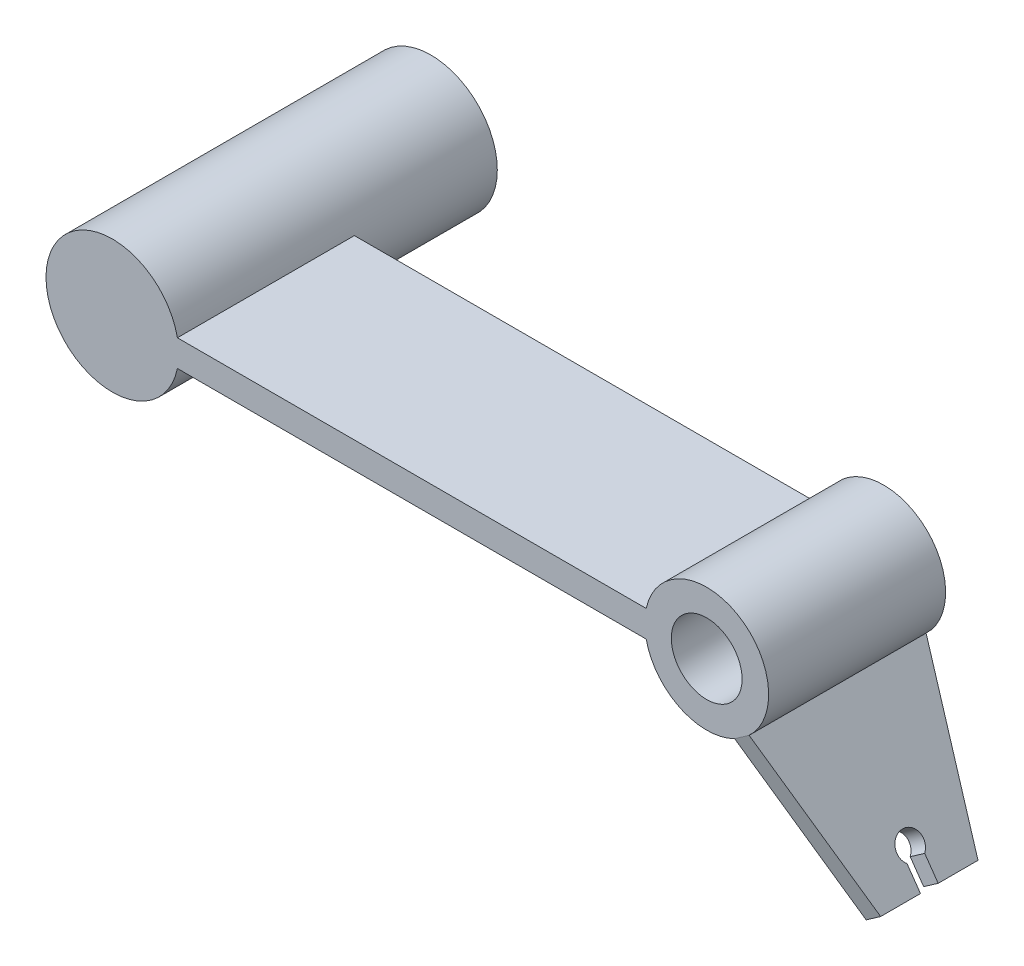
from build123d import *

# Parameters (mm, degrees)
SKETCH2_R           = 4
BOSS_EXTRUDE1_DEPTH = 20
SKETCH3_R           = 7.5
BOSS_EXTRUDE2_DEPTH = 36
BOSS_EXTRUDE3_START = -20
BOSS_EXTRUDE3_DEPTH = 20
CUT_EXTRUDE1_DEPTH  = 2
CUT_EXTRUDE2_REACH  = 83.026
BOSS_EXTRUDE4_DEPTH = 2


with BuildPart() as part:
    # Sketch2 → Boss-Extrude1 (new body)
    with BuildSketch(Plane.XY):
        with BuildLine():
            Line((-67.162602834, 1.5), (-6.837397166, 1.5))
            ThreePointArc((-6.837397166, 1.5), (7, 0), (-6.837397166, -1.5))
            Line((-6.837397166, -1.5), (-67.162602834, -1.5))
            Line((-67.162602834, -1.5), (-67.162602834, 1.5))
        make_face()
        Circle(SKETCH2_R, mode=Mode.SUBTRACT)
    extrude(amount=BOSS_EXTRUDE1_DEPTH)

    # Sketch3 → Boss-Extrude2 (add)
    with BuildSketch(Plane.XY.offset(20)):
        with Locations((-67.162602834, 0)):
            Circle(SKETCH3_R)
    extrude(amount=-BOSS_EXTRUDE2_DEPTH)

    # Sketch4 → Boss-Extrude3 (add)
    with BuildSketch(Plane.XY.offset(20).offset(BOSS_EXTRUDE3_START)):
        with BuildLine():
            Line((15.158562953, -19.905224671), (13.520258864, -21.052377544))
            Line((13.520258864, -21.052377544), (3.154702075, -6.248828276))
            ThreePointArc((3.154702075, -6.248828276), (4.015035054, -5.73406431), (4.793006163, -5.101675403))
            Line((4.793006163, -5.101675403), (15.158562953, -19.905224671))
        make_face()
    extrude(amount=BOSS_EXTRUDE3_DEPTH)

    # Sketch5 → Cut-Extrude1 (cut)
    with BuildSketch(Plane(origin=(0.8191520442889967, 0.5735764363510467, 0), x_dir=(0, 0, -1), z_dir=(0.8191520442889931, 0.5735764363510442, 0))):
        with BuildLine():
            Line((-11, -22.346237219), (-11, -25))
            Line((-11, -25), (-9, -25))
            Line((-9, -25), (-9, -22.346237219))
            ThreePointArc((-9, -22.346237219), (-10, -19.72820323), (-11, -22.346237219))
        make_face()
    extrude(amount=-CUT_EXTRUDE1_DEPTH, mode=Mode.SUBTRACT)

    # Sketch6 → Cut-Extrude2 (cut, up to next)
    with BuildSketch(Plane(origin=(0.8191520442889967, 0.5735764363510467, 0), x_dir=(0, 0, -1), z_dir=(0.8191520442889931, 0.5735764363510442, 0)), mode=Mode.PRIVATE) as cut_extrude2_sk1:
        Polygon((-20, -6.92820323), (-15.5, -25), (-21.37977423, -25), (-21.37977423, -6.621098629), align=None)
    cut_extrude2_tool1 = extrude(cut_extrude2_sk1.sketch, amount=-CUT_EXTRUDE2_REACH, mode=Mode.PRIVATE) & part.part
    # Sketch6 → Cut-Extrude2 (cut, up to next)
    with BuildSketch(Plane(origin=(0.8191520442889967, 0.5735764363510467, 0), x_dir=(0, 0, -1), z_dir=(0.8191520442889931, 0.5735764363510442, 0)), mode=Mode.PRIVATE) as cut_extrude2_sk2:
        Polygon((0, -6.92820323), (1.41409792, -6.92820323), (1.41409792, -25), (-4.5, -25), align=None)
    cut_extrude2_tool2 = extrude(cut_extrude2_sk2.sketch, amount=-CUT_EXTRUDE2_REACH, mode=Mode.PRIVATE) & part.part
    add(cut_extrude2_tool1.solids().sort_by_distance((11.026351, -14.003814, 19.337545))[0], mode=Mode.SUBTRACT)
    add(cut_extrude2_tool2.solids().sort_by_distance((11.036642, -14.018511, 0.648226))[0], mode=Mode.SUBTRACT)

    # Sketch7 → Boss-Extrude4 (add)
    with BuildSketch(Plane.XY.offset(9)):
        Polygon((-25.248427633, -1.5), (8.33748047, -13.65060291), (3.154702075, -6.248828276), (-6.837397166, -1.5), align=None)
    extrude(amount=BOSS_EXTRUDE4_DEPTH)


solid = part.part
